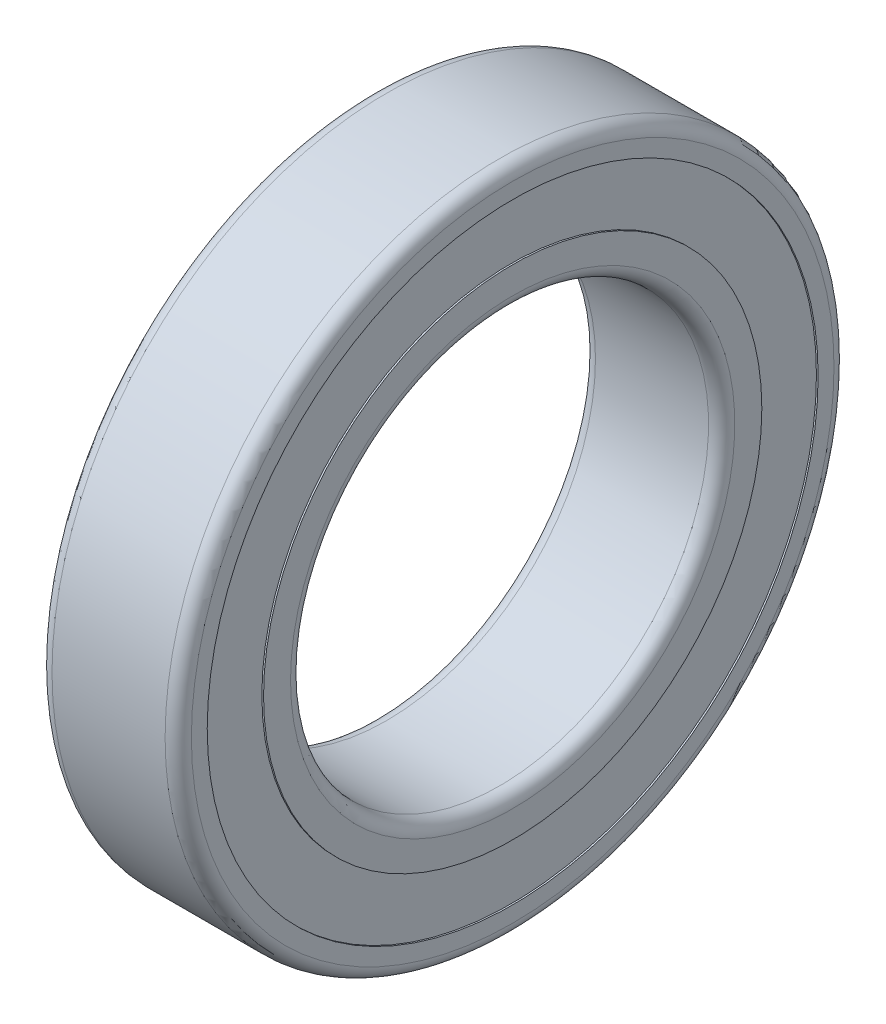
from build123d import *

# Parameters (mm, degrees)
SKETCH_3_W               = 0.17
SKETCH_3_H               = 2.02
PATTERN_CIRCULAR_2_COUNT = 13
FILLET_1_R               = 0.4712
FILLET_2_R               = 0.4712


with BuildPart() as part:
    # ｽｹｯﾁ1 → 回転1 (revolve)
    with BuildSketch(Plane.XY, mode=Mode.PRIVATE) as revolve_1_sk:
        with BuildLine():
            Line((-2.5, 12), (2.5, 12))
            Line((2.5, 12), (2.5, 10.96))
            Line((2.5, 10.96), (2.27, 10.96))
            Line((2.27, 10.96), (2.27, 10.56))
            Line((2.27, 10.56), (1.08, 10.56))
            ThreePointArc((1.08, 10.56), (0, 11.1), (-1.08, 10.56))
            Line((-1.08, 10.56), (-2.27, 10.56))
            Line((-2.27, 10.56), (-2.27, 10.96))
            Line((-2.27, 10.96), (-2.5, 10.96))
            Line((-2.5, 10.96), (-2.5, 12))
        make_face()
        with BuildLine():
            Line((-2.5, 8.94), (-1.08, 8.94))
            ThreePointArc((-1.08, 8.94), (0, 8.4), (1.08, 8.94))
            Line((1.08, 8.94), (2.5, 8.94))
            Line((2.5, 8.94), (2.5, 7.5))
            Line((2.5, 7.5), (-2.5, 7.5))
            Line((-2.5, 7.5), (-2.5, 8.94))
        make_face()
    revolve(revolve_1_sk.sketch.rotate(Axis((0, 0, 0), (1, 0, 0)), 90), axis=Axis((0, 0, 0), (1, 0, 0)))

    # ﾌｨﾚｯﾄ1
    fillet_1_edges = [part.edges().sort_by_distance(p)[0] for p in [
        (-2.5, 0, -12),
        (2.5, 0, -12),
    ]]
    fillet(fillet_1_edges, radius=FILLET_1_R)

    # ﾌｨﾚｯﾄ2
    fillet_2_edges = [part.edges().sort_by_distance(p)[0] for p in [
        (2.5, 0, -7.5),
        (-2.5, 0, -7.5),
    ]]
    fillet(fillet_2_edges, radius=FILLET_2_R)


with BuildPart() as body_2:
    # ｽｹｯﾁ3 → 回転3 (revolve)
    with BuildSketch(Plane.XY, mode=Mode.PRIVATE) as revolve_3_sk:
        with Locations((2.355, 9.95)):
            Rectangle(SKETCH_3_W, SKETCH_3_H)
        with Locations((-2.355, 9.95)):
            Rectangle(SKETCH_3_W, SKETCH_3_H)
    revolve(revolve_3_sk.sketch.rotate(Axis((0, 0, 0), (1, 0, 0)), 90), axis=Axis((0, 0, 0), (1, 0, 0)))


with BuildPart() as body_3:
    # ｽｹｯﾁ2 → 回転2 (revolve)
    with BuildSketch(Plane.XY):
        with BuildLine():
            Line((-1.3275, 9.75), (1.3275, 9.75))
            ThreePointArc((1.3275, 9.75), (0, 11.0775), (-1.3275, 9.75))
        make_face()
    revolve(axis=Axis((0.04685524, 9.75, 0), (1, 0, 0)))


with BuildPart() as pattern_circular_2_1:
    # 円形ﾊﾟﾀｰﾝ2: pattern copy
    add(body_3.part.rotate(Axis((0, 0, 0), (1, 0, 0)), 1 * 360 / PATTERN_CIRCULAR_2_COUNT))


with BuildPart() as pattern_circular_2_2:
    # 円形ﾊﾟﾀｰﾝ2: pattern copy
    add(body_3.part.rotate(Axis((0, 0, 0), (1, 0, 0)), 2 * 360 / PATTERN_CIRCULAR_2_COUNT))


with BuildPart() as pattern_circular_2_3:
    # 円形ﾊﾟﾀｰﾝ2: pattern copy
    add(body_3.part.rotate(Axis((0, 0, 0), (1, 0, 0)), 3 * 360 / PATTERN_CIRCULAR_2_COUNT))


with BuildPart() as pattern_circular_2_4:
    # 円形ﾊﾟﾀｰﾝ2: pattern copy
    add(body_3.part.rotate(Axis((0, 0, 0), (1, 0, 0)), 4 * 360 / PATTERN_CIRCULAR_2_COUNT))


with BuildPart() as pattern_circular_2_5:
    # 円形ﾊﾟﾀｰﾝ2: pattern copy
    add(body_3.part.rotate(Axis((0, 0, 0), (1, 0, 0)), 5 * 360 / PATTERN_CIRCULAR_2_COUNT))


with BuildPart() as pattern_circular_2_6:
    # 円形ﾊﾟﾀｰﾝ2: pattern copy
    add(body_3.part.rotate(Axis((0, 0, 0), (1, 0, 0)), 6 * 360 / PATTERN_CIRCULAR_2_COUNT))


with BuildPart() as pattern_circular_2_7:
    # 円形ﾊﾟﾀｰﾝ2: pattern copy
    add(body_3.part.rotate(Axis((0, 0, 0), (1, 0, 0)), 7 * 360 / PATTERN_CIRCULAR_2_COUNT))


with BuildPart() as pattern_circular_2_8:
    # 円形ﾊﾟﾀｰﾝ2: pattern copy
    add(body_3.part.rotate(Axis((0, 0, 0), (1, 0, 0)), 8 * 360 / PATTERN_CIRCULAR_2_COUNT))


with BuildPart() as pattern_circular_2_9:
    # 円形ﾊﾟﾀｰﾝ2: pattern copy
    add(body_3.part.rotate(Axis((0, 0, 0), (1, 0, 0)), 9 * 360 / PATTERN_CIRCULAR_2_COUNT))


with BuildPart() as pattern_circular_2_10:
    # 円形ﾊﾟﾀｰﾝ2: pattern copy
    add(body_3.part.rotate(Axis((0, 0, 0), (1, 0, 0)), 10 * 360 / PATTERN_CIRCULAR_2_COUNT))


with BuildPart() as pattern_circular_2_11:
    # 円形ﾊﾟﾀｰﾝ2: pattern copy
    add(body_3.part.rotate(Axis((0, 0, 0), (1, 0, 0)), 11 * 360 / PATTERN_CIRCULAR_2_COUNT))


with BuildPart() as pattern_circular_2_12:
    # 円形ﾊﾟﾀｰﾝ2: pattern copy
    add(body_3.part.rotate(Axis((0, 0, 0), (1, 0, 0)), 12 * 360 / PATTERN_CIRCULAR_2_COUNT))


solid = Compound([part.part, body_2.part, body_3.part, pattern_circular_2_1.part, pattern_circular_2_2.part, pattern_circular_2_3.part, pattern_circular_2_4.part, pattern_circular_2_5.part, pattern_circular_2_6.part, pattern_circular_2_7.part, pattern_circular_2_8.part, pattern_circular_2_9.part, pattern_circular_2_10.part, pattern_circular_2_11.part, pattern_circular_2_12.part])
